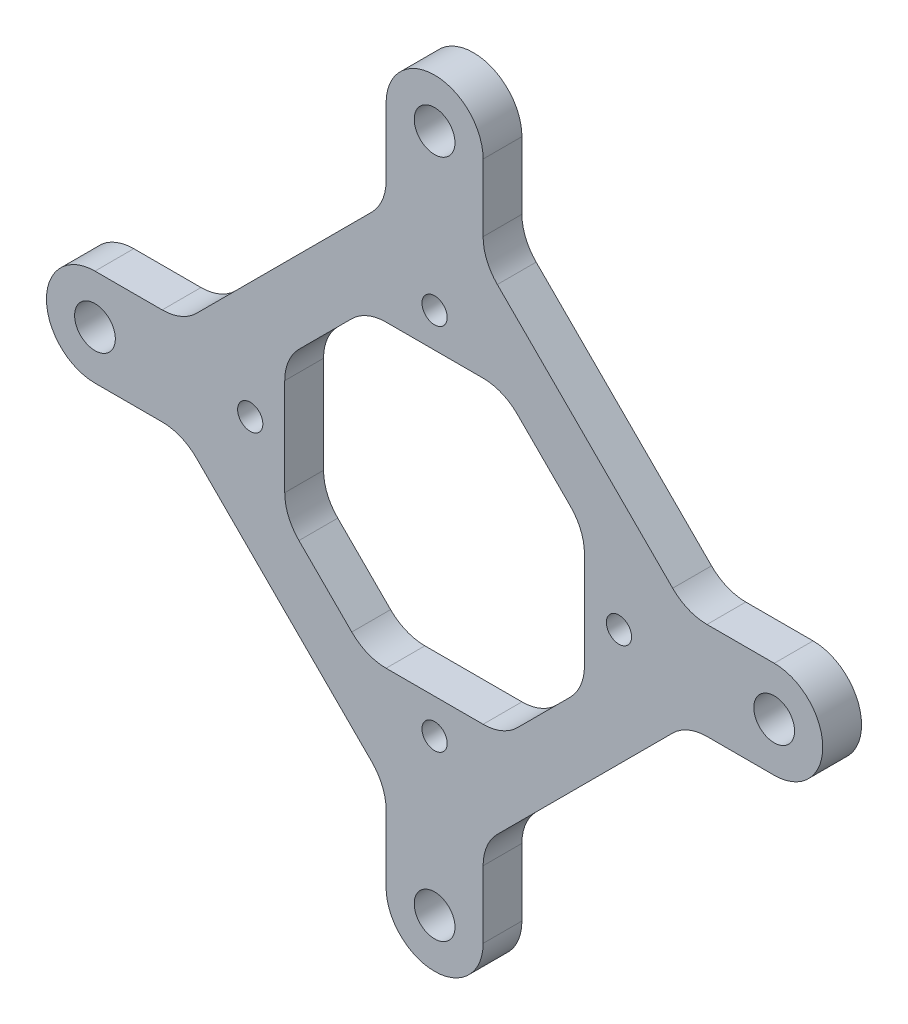
from build123d import *

# Parameters (mm, degrees)
SKETCH_1_R          = 2.1
SKETCH_1_W          = 10
SKETCH_1_H          = 10
EXTRUDE_1_DEPTH     = 4
CHAMFER_1_SIZE      = 21
SKETCH_2_R          = 1.3
CUT_EXTRUDE_1_DEPTH = 57.709787515
FILLET_3_R          = 5


with BuildPart() as part:
    # 草图1 → 凸台-拉伸1 (new body)
    # profile 1 of 5: a face of its own
    with BuildSketch(Plane.XY):
        with BuildLine():
            Line((5, 5), (5, 35))
            ThreePointArc((5, 35), (0, 40), (-5, 35))
            Line((-5, 35), (-5, 5))
            Line((-5, 5), (5, 5))
        make_face()
        with Locations((0, 35)):
            Circle(SKETCH_1_R, mode=Mode.SUBTRACT)
    # profile 2 of 5: a face of its own
    with BuildSketch(Plane.XY):
        with BuildLine():
            Line((5, -35), (5, -5))
            Line((5, -5), (-5, -5))
            Line((-5, -5), (-5, -35))
            ThreePointArc((-5, -35), (0, -40), (5, -35))
        make_face()
        with Locations((0, -35)):
            Circle(SKETCH_1_R, mode=Mode.SUBTRACT)
    # profile 3 of 5: a face of its own
    with BuildSketch(Plane.XY):
        Rectangle(SKETCH_1_W, SKETCH_1_H)
    # profile 4 of 5: a face of its own
    with BuildSketch(Plane.XY):
        with BuildLine():
            Line((35, 5), (5, 5))
            Line((5, 5), (5, -5))
            Line((5, -5), (35, -5))
            ThreePointArc((35, -5), (40, 0), (35, 5))
        make_face()
        with Locations((35, 0)):
            Circle(SKETCH_1_R, mode=Mode.SUBTRACT)
    # profile 5 of 5: a face of its own
    with BuildSketch(Plane.XY):
        with BuildLine():
            Line((-5, -5), (-5, 5))
            Line((-5, 5), (-35, 5))
            ThreePointArc((-35, 5), (-40, 0), (-35, -5))
            Line((-35, -5), (-5, -5))
        make_face()
        with Locations((-35, 0)):
            Circle(SKETCH_1_R, mode=Mode.SUBTRACT)
    extrude(amount=EXTRUDE_1_DEPTH)

    # 倒角1
    chamfer_1_edges = [part.edges().sort_by_distance(p)[0] for p in [
        (5, 5, 2),
        (5, -5, 2),
        (-5, -5, 2),
        (-5, 5, 2),
    ]]
    chamfer(chamfer_1_edges, length=CHAMFER_1_SIZE)

    # 草图2 → 切除-拉伸1 (cut, through all)
    with BuildSketch(Plane.XY.offset(4)):
        with Locations((0, 19)):
            Circle(SKETCH_2_R)
        with Locations((19, 0)):
            Circle(SKETCH_2_R)
        with Locations((0, -19)):
            Circle(SKETCH_2_R)
        with Locations((-19, 0)):
            Circle(SKETCH_2_R)
        Polygon((-7.071067812, 15.443650814), (-15.443650814, 7.071067812), (-15.443650814, -7.071067812), (-7.071067812, -15.443650814), (7.071067812, -15.443650814), (15.443650814, -7.071067812), (15.443650814, 7.071067812), (7.071067812, 15.443650814), align=None)
    extrude(amount=-CUT_EXTRUDE_1_DEPTH, mode=Mode.SUBTRACT)

    # 圆角3
    fillet_3_edges = [part.edges().sort_by_distance(p)[0] for p in [
        (15.443650814, -7.071067812, 2),
        (7.071067812, -15.443650814, 2),
        (-7.071067812, -15.443650814, 2),
        (-15.443650814, -7.071067812, 2),
        (-15.443650814, 7.071067812, 2),
        (-5, -26, 2),
        (-26, -5, 2),
        (26, -5, 2),
        (5, -26, 2),
        (5, 26, 2),
        (26, 5, 2),
        (-26, 5, 2),
        (-5, 26, 2),
        (-7.071067812, 15.443650814, 2),
        (7.071067812, 15.443650814, 2),
        (15.443650814, 7.071067812, 2),
    ]]
    fillet(fillet_3_edges, radius=FILLET_3_R)


solid = part.part
